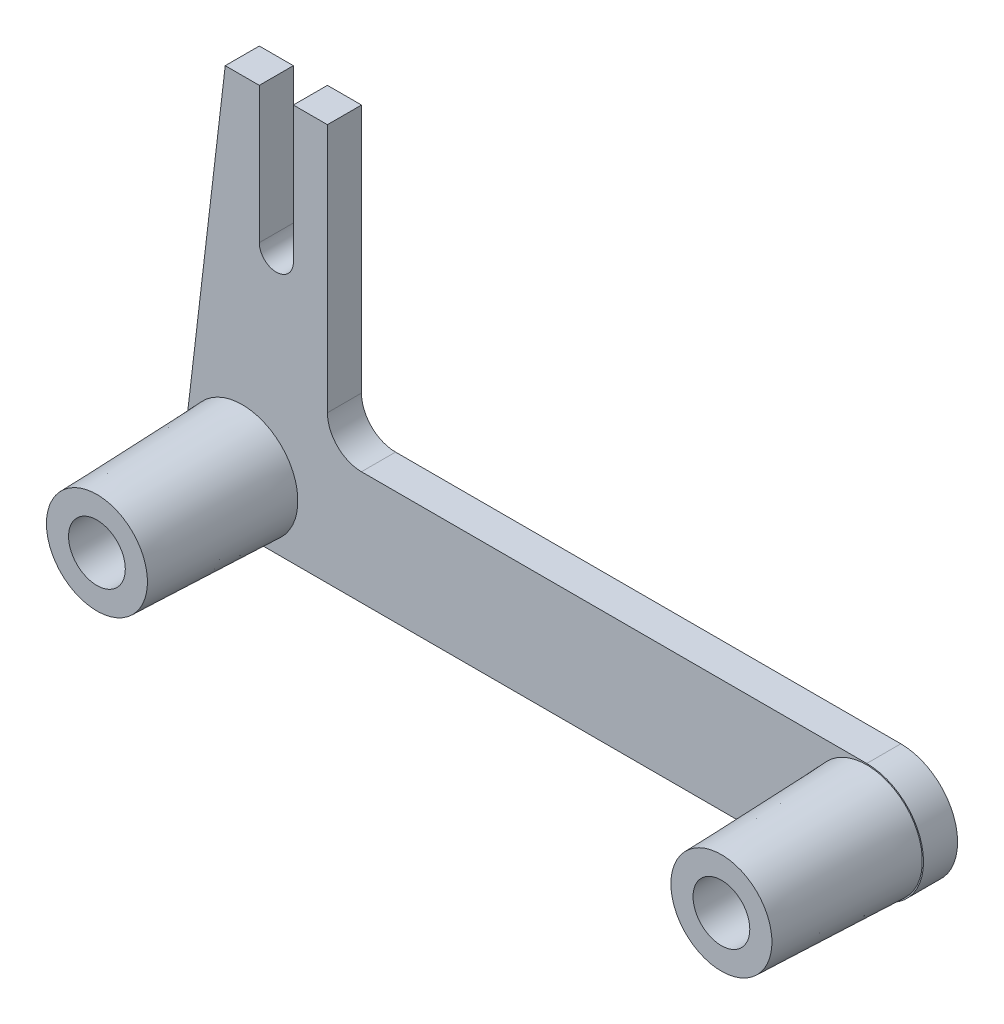
from build123d import *

# Parameters (mm, degrees)
BASE_EXTRUSION_DEPTH         = 3
ESQUISSE3_R                  = 4.999999999999999
BOSS_EXTRU_1_DEPTH           = 15.8
BOSS_EXTRU_1_DRAFT           = -2.0000000000000044
ESQUISSE3_R_2                = 4.9999999999999964
BOSS_EXTRU_1_PROFILE_2_DEPTH = 15.8
BOSS_EXTRU_1_PROFILE_2_DRAFT = -2.0000000000000044
PER_AGE1_D                   = 5
PER_AGE1_DEPTH               = 15.8
PER_AGE1_TIP                 = 1.5021515475689007
PER_AGE3_D                   = 5
PER_AGE3_DEPTH               = 15.8
PER_AGE3_TIP                 = 1.5021515475689007


with BuildPart() as part:
    # Esquisse1 → Base-Extrusion (new body)
    with BuildSketch(Plane.XY):
        with BuildLine():
            Line((0.6787939241914508, -3.1163780736354636), (55.149951438834705, -3.116378073635477))
            ThreePointArc((55.149951438834705, -3.116378073635477), (60.149951438834705, 1.883621926364523), (55.149951438834705, 6.883621926364523))
            Line((55.149951438834705, 6.883621926364523), (10.649951438834709, 6.883621926364541))
            ThreePointArc((10.649951438834709, 6.883621926364541), (8.528631095275069, 7.7623015828049), (7.649951438834709, 9.88362192636454))
            Line((7.649951438834709, 9.88362192636454), (7.649951438834716, 31.855575830583856))
            Line((7.649951438834716, 31.855575830583856), (4.649951438834716, 31.855575830583856))
            Line((4.649951438834716, 31.855575830583856), (4.649951438834713, 19.855575830583852))
            ThreePointArc((4.649951438834713, 19.855575830583852), (3.149951438834714, 18.355575830583852), (1.6499514388347154, 19.855575830583852))
            Line((1.6499514388347154, 19.855575830583852), (1.6499514388347158, 31.85557583058385))
            Line((1.6499514388347158, 31.85557583058385), (-1.350048561165284, 31.855575830583856))
            Line((-1.350048561165284, 31.855575830583856), (-4.815702167023938, 2.440626483624255))
            ThreePointArc((-4.815702167023938, 2.440626483624255), (-3.4055229517499925, -1.6599044862286791), (0.6787939241914508, -3.1163780736354636))
        make_face()
    extrude(amount=BASE_EXTRUSION_DEPTH)


with BuildPart() as boss_extru_1_tool:
    # Esquisse3 → Boss.-Extru.1 (with draft: the straight prism first)
    with BuildSketch(Plane(origin=(0, 0, 0), x_dir=(-1, 0, 0), z_dir=(0, 0, -1))):
        with Locations((-0.1499514388347119, 1.8555758305838532)):
            Circle(ESQUISSE3_R)
    extrude(amount=-BOSS_EXTRU_1_DEPTH)
    # Boss.-Extru.1: the draft: its side faces are tilted about the plane it starts from
    boss_extru_1_sides = [boss_extru_1_tool.faces().sort_by_distance(p)[0] for p in [
        (5.149951439, 1.855575831, 7.9),
    ]]
    draft(boss_extru_1_sides, Plane(origin=(0, 0, 0), x_dir=(-1, 0, 0), z_dir=(0, 0, -1)), BOSS_EXTRU_1_DRAFT)


with BuildPart() as part_1:
    add(part.part)

    # Boss.-Extru.1: add boss_extru_1_tool
    add(boss_extru_1_tool.part)


with BuildPart() as boss_extru_1_profile_2_tool:
    # Esquisse3 → Boss.-Extru.1 profile 2 (with draft: the straight prism first)
    with BuildSketch(Plane(origin=(0, 0, 0), x_dir=(-1, 0, 0), z_dir=(0, 0, -1))):
        with Locations((-55.149951438834705, 1.883621926364523)):
            Circle(ESQUISSE3_R_2)
    extrude(amount=-BOSS_EXTRU_1_PROFILE_2_DEPTH)
    # Boss.-Extru.1 profile 2: the draft: its side faces are tilted about the plane it starts from
    boss_extru_1_profile_2_sides = [boss_extru_1_profile_2_tool.faces().sort_by_distance(p)[0] for p in [
        (60.149951439, 1.883621926, 7.9),
    ]]
    draft(boss_extru_1_profile_2_sides, Plane(origin=(0, 0, 0), x_dir=(-1, 0, 0), z_dir=(0, 0, -1)), BOSS_EXTRU_1_PROFILE_2_DRAFT)


with BuildPart() as part_2:
    add(part_1.part)

    # Boss.-Extru.1 profile 2: add boss_extru_1_profile_2_tool
    add(boss_extru_1_profile_2_tool.part)

    # Perçage1
    with Locations(Plane.XY.offset(15.8)):
        with Locations((55.149951439, 1.883621926)):
            Hole(PER_AGE1_D / 2, depth=PER_AGE1_DEPTH)
            with Locations((0, 0, -(PER_AGE1_DEPTH + PER_AGE1_TIP / 2))):  # 118° drill point
                Cone(0, PER_AGE1_D / 2, PER_AGE1_TIP, mode=Mode.SUBTRACT)

    # Perçage3
    with Locations(Plane.XY.offset(15.8)):
        with Locations((0.149951439, 1.855575831)):
            Hole(PER_AGE3_D / 2, depth=PER_AGE3_DEPTH)
            with Locations((0, 0, -(PER_AGE3_DEPTH + PER_AGE3_TIP / 2))):  # 118° drill point
                Cone(0, PER_AGE3_D / 2, PER_AGE3_TIP, mode=Mode.SUBTRACT)


solid = part_2.part
